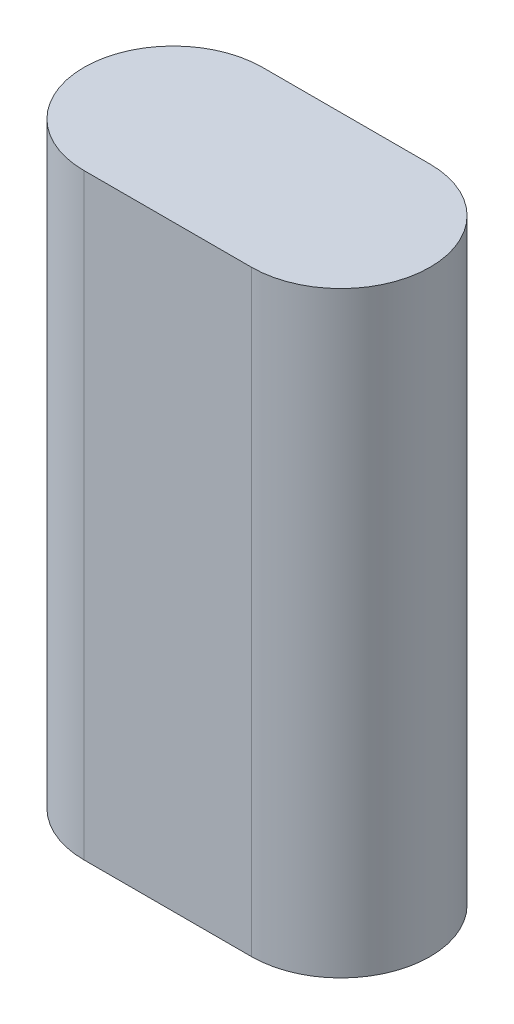
from build123d import *

# Parameters (mm, degrees)
EXTRUDE_1_DEPTH = 119


with BuildPart() as part:
    # ｽｹｯﾁ1 → ﾎﾞｽ - 押し出し1 (new body)
    with BuildSketch(Plane(origin=(0, 0, 0), x_dir=(1, 0, 0), z_dir=(0, 1, 0))):
        with BuildLine():
            Line((-16.7, 17.8), (16.7, 17.8))
            ThreePointArc((16.7, 17.8), (34.5, 0), (16.7, -17.8))
            Line((16.7, -17.8), (-16.7, -17.8))
            ThreePointArc((-16.7, -17.8), (-34.5, 0), (-16.7, 17.8))
        make_face()
    extrude(amount=EXTRUDE_1_DEPTH)


solid = part.part
